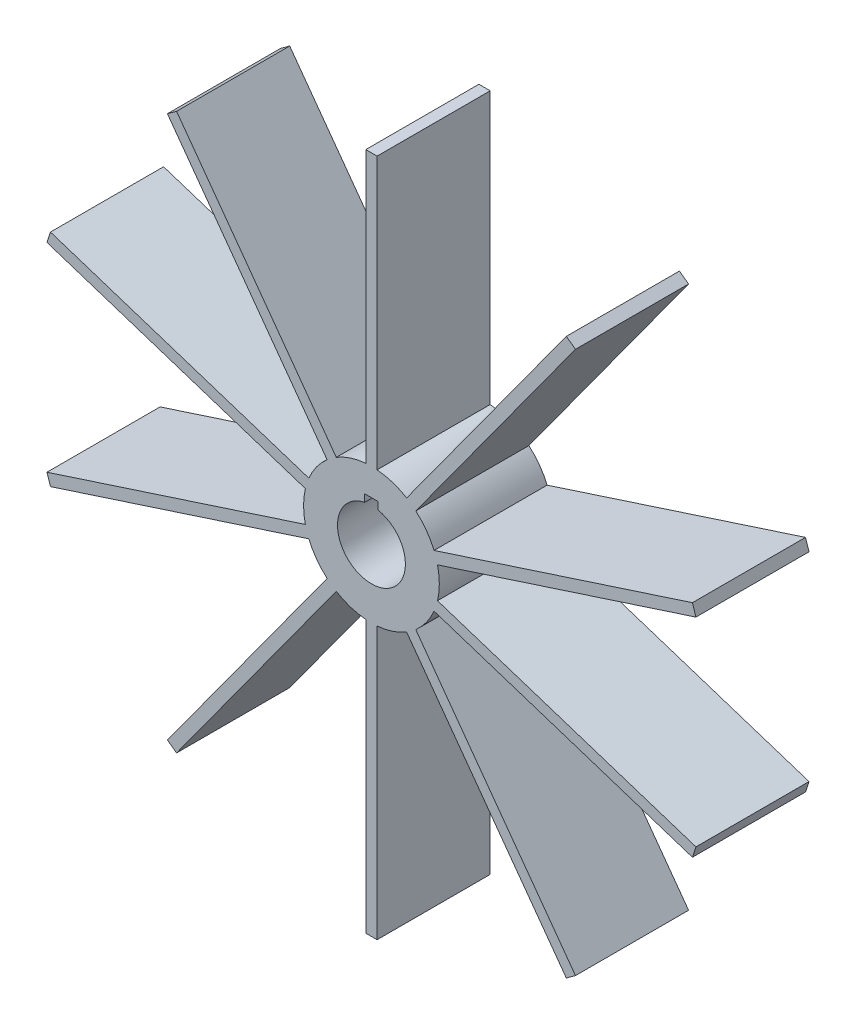
from build123d import *

# Parameters (mm, degrees)
SKETCH_1_R               = 30
EXTRUDE_1_DEPTH          = 50
CUT_EXTRUDE_1_DEPTH      = 66.574385243
EXTRUDE_2_REACH          = 191.209
EXTRUDE_2_END_RADIUS     = 30
SKETCH_3_W               = 5
SKETCH_3_H               = 50
PATTERN_CIRCULAR_1_COUNT = 10


with BuildPart() as part:
    # 草图1 → 凸台-拉伸1 (new body)
    with BuildSketch(Plane.XY):
        Circle(SKETCH_1_R)
    extrude(amount=EXTRUDE_1_DEPTH)

    # 草图2 → 切除-拉伸1 (cut, through all)
    with BuildSketch(Plane.XY.offset(50)):
        with BuildLine():
            Line((-3, 18), (3, 18))
            Line((3, 18), (3, 14.696938457))
            ThreePointArc((3, 14.696938457), (0, -15), (-3, 14.696938457))
            Line((-3, 14.696938457), (-3, 18))
        make_face()
    extrude(amount=-CUT_EXTRUDE_1_DEPTH, mode=Mode.SUBTRACT)

    # 凸台-拉伸2: up to this cylinder (the profile starts outside it)
    extrude_2_end = Plane(origin=(0, 0, 25), z_dir=(0, 0, -1)) * Cylinder(EXTRUDE_2_END_RADIUS, 443.418, mode=Mode.PRIVATE)
    # 草图3 → 凸台-拉伸2 (add, up to the surface)
    with BuildSketch(Plane(origin=(0, 150, 0), x_dir=(1, 0, 0), z_dir=(0, 1, 0)), mode=Mode.PRIVATE) as extrude_2_sk1:
        with Locations((0, -25)):
            Rectangle(SKETCH_3_W, SKETCH_3_H)
    extrude_2_tool1 = extrude(extrude_2_sk1.sketch, amount=-EXTRUDE_2_REACH, mode=Mode.PRIVATE) - extrude_2_end
    extrude_2 = extrude_2_tool1.solids().sort_by_distance((0, 150, 25))[0]
    add(extrude_2)

    # 阵列(圆周)1: 凸台-拉伸2 ×10 about axis
    pattern_circular_1_axis = Axis((0, 0, 0), (0, 0, 1))
    for i in range(1, PATTERN_CIRCULAR_1_COUNT):
        add(extrude_2.rotate(pattern_circular_1_axis, i * 360 / PATTERN_CIRCULAR_1_COUNT))


solid = part.part
